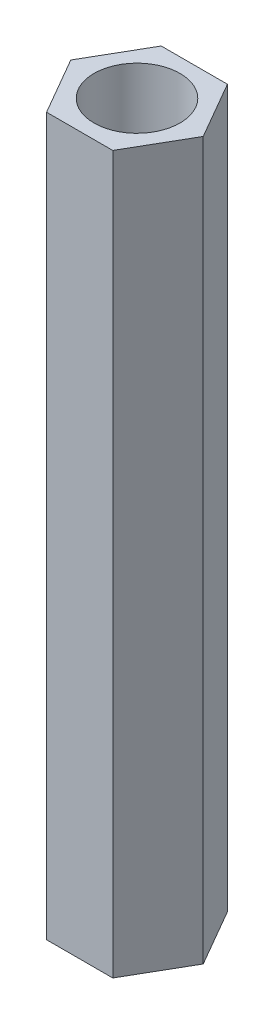
from build123d import *

# Parameters (mm, degrees)
EXTRUDE_1_DEPTH     = 25
SKETCH_2_R          = 1.5
CUT_EXTRUDE_1_DEPTH = 26.185974933


with BuildPart() as part:
    # 草图1 → 凸台-拉伸1 (new body)
    with BuildSketch(Plane(origin=(0, 0, 0), x_dir=(1, 0, 0), z_dir=(0, 1, 0))):
        Polygon((2.309401077, 0), (1.154700538, 2), (-1.154700538, 2), (-2.309401077, 0), (-1.154700538, -2), (1.154700538, -2), align=None)
    extrude(amount=EXTRUDE_1_DEPTH)

    # 草图2 → 切除-拉伸1 (cut, through all)
    with BuildSketch(Plane(origin=(0, 25, 0), x_dir=(1, 0, 0), z_dir=(0, 1, 0))):
        with Locations(Location((0, 0, 0), (0, 0, 270))):
            Circle(SKETCH_2_R)
    extrude(amount=-CUT_EXTRUDE_1_DEPTH, mode=Mode.SUBTRACT)


solid = part.part
